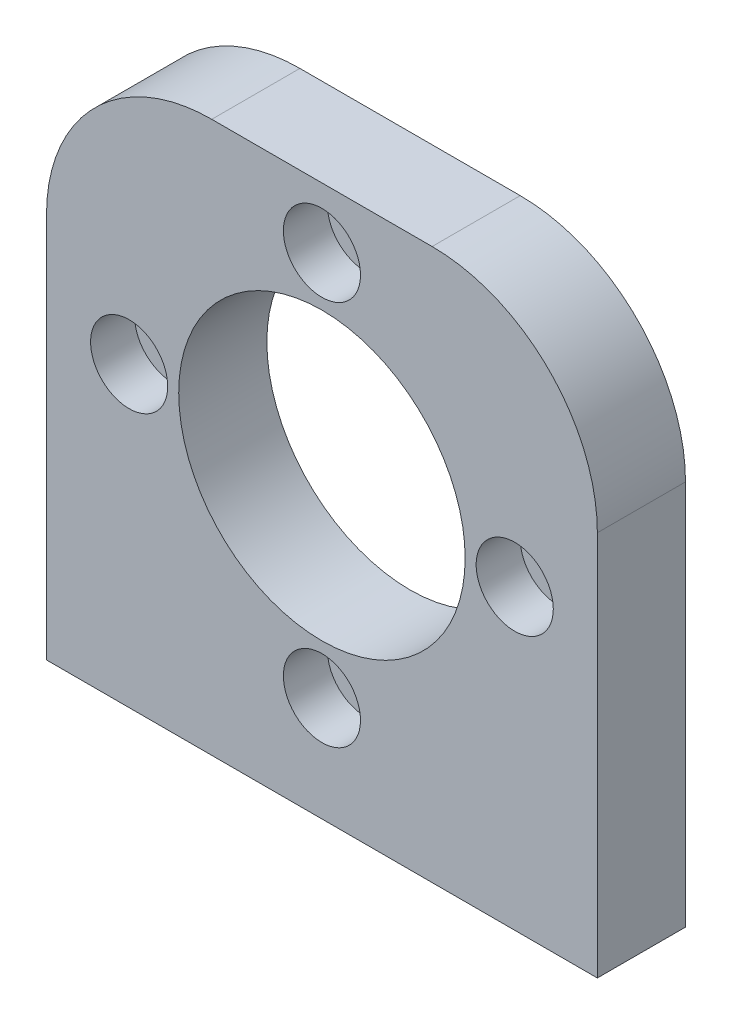
from build123d import *

# Parameters (mm, degrees)
SKETCH_1_W                     = 50
SKETCH_1_H                     = 50
EXTRUDE_1_DEPTH                = 8
HOLE_WIZARD_M22_1_D            = 26
HOLE_WIZARD_M3_5_1_D           = 4
HOLE_WIZARD_M3_5_1_CBORE_D     = 7
HOLE_WIZARD_M3_5_1_CBORE_DEPTH = 4
HOLE_WIZARD_4_2_4_2_1_D        = 4.2
HOLE_WIZARD_4_2_4_2_1_DEPTH    = 12.4
HOLE_WIZARD_4_2_4_2_1_TIP      = 1.2618073
FILLET_1_R                     = 15


with BuildPart() as part:
    # 草图1 → 凸台-拉伸1 (new body)
    with BuildSketch(Plane.XY.offset(8)):
        with Locations((39.062572137, 28.826485826)):
            Rectangle(SKETCH_1_W, SKETCH_1_H)
    extrude(amount=-EXTRUDE_1_DEPTH)

    # M22 间隙孔1 (through all)
    with Locations(Plane(origin=(0, 0, 0), x_dir=(-1, 0, 0), z_dir=(0, 0, -1))):
        with Locations((-39.062572137, 30.829359323)):
            Hole(HOLE_WIZARD_M22_1_D / 2)

    # M3.5 六角头机械螺钉的柱形沉头孔1 (through all)
    with Locations(Plane.XY.offset(8)):
        with Locations((39.062572137, 13.329359323), (39.062572137, 48.329359323), (56.562572137, 30.829359323), (21.562572137, 30.829359323)):
            CounterBoreHole(HOLE_WIZARD_M3_5_1_D / 2, HOLE_WIZARD_M3_5_1_CBORE_D / 2, HOLE_WIZARD_M3_5_1_CBORE_DEPTH)

    # Ø4.2 (4.2) 直径孔1
    with Locations(Plane(origin=(0, 3.826485826, 0), x_dir=(-1, 0, 0), z_dir=(0, -1, 0))):
        with Locations((-24.062572137, -4), (-54.062572137, -4)):
            Hole(HOLE_WIZARD_4_2_4_2_1_D / 2, depth=HOLE_WIZARD_4_2_4_2_1_DEPTH)
            with Locations((0, 0, -(HOLE_WIZARD_4_2_4_2_1_DEPTH + HOLE_WIZARD_4_2_4_2_1_TIP / 2))):  # 118° drill point
                Cone(0, HOLE_WIZARD_4_2_4_2_1_D / 2, HOLE_WIZARD_4_2_4_2_1_TIP, mode=Mode.SUBTRACT)

    # 圆角1
    fillet_1_edges = [part.edges().sort_by_distance(p)[0] for p in [
        (64.062572137, 53.826485826, 4),
        (14.062572137, 53.826485826, 4),
    ]]
    fillet(fillet_1_edges, radius=FILLET_1_R)


solid = part.part
